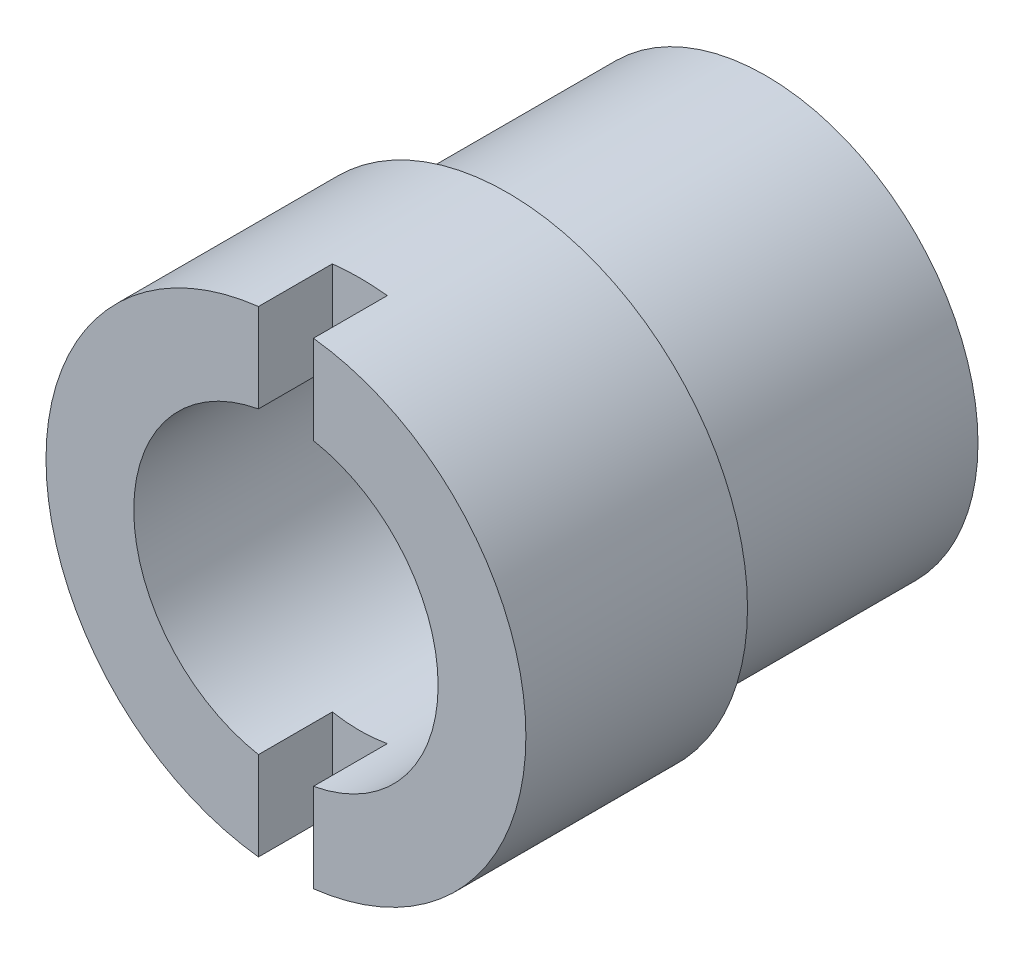
from build123d import *

# Parameters (mm, degrees)
SKETCH1_R               = 10.3124
SKETCH1_R_2             = 6.5405
BOSS_EXTRUDE1_DEPTH     = 9.525
SKETCH2_R               = 9.1186
SKETCH2_R_2             = 6.5405
BOSS_EXTRUDE2_DEPTH     = 11.0998
CUT_EXTRUDE1_DEPTH      = 26.260118023
CUT_EXTRUDE1_DEPTH_BACK = 26.260118023
SKETCH3_W               = 2.3622
SKETCH3_H               = 3.175


with BuildPart() as part:
    # Sketch1 → Boss-Extrude1 (new body)
    with BuildSketch(Plane.XY):
        Circle(SKETCH1_R)
        Circle(SKETCH1_R_2, mode=Mode.SUBTRACT)
    extrude(amount=-BOSS_EXTRUDE1_DEPTH)

    # Sketch2 → Boss-Extrude2 (add)
    with BuildSketch(Plane(origin=(0, 0, -9.525), x_dir=(-1, 0, 0), z_dir=(0, 0, -1))):
        Circle(SKETCH2_R)
        with Locations(Location((0, 0, 0), (0, 0, 180))):
            Circle(SKETCH2_R_2, mode=Mode.SUBTRACT)
    extrude(amount=BOSS_EXTRUDE2_DEPTH)

    # Sketch3 → Cut-Extrude1 (cut, two sides: drawn at the far end of the back side and taken through both)
    with BuildSketch(Plane(origin=(0, 0, 0), x_dir=(1, 0, 0), z_dir=(0, 1, 0)).offset(-CUT_EXTRUDE1_DEPTH_BACK)):
        with Locations((0, 1.5875)):
            Rectangle(SKETCH3_W, SKETCH3_H)
    extrude(amount=CUT_EXTRUDE1_DEPTH + CUT_EXTRUDE1_DEPTH_BACK, mode=Mode.SUBTRACT)


solid = part.part
